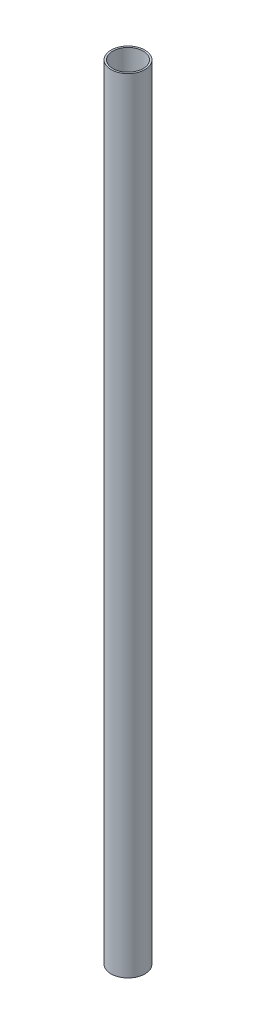
from build123d import *

# Parameters (mm, degrees)
SKETCH1_R           = 3.96875
SKETCH1_R_2         = 3.56235
BOSS_EXTRUDE1_DEPTH = 183.642


with BuildPart() as part:
    # Sketch1 → Boss-Extrude1 (new body)
    with BuildSketch(Plane(origin=(0, 0, 0), x_dir=(1, 0, 0), z_dir=(0, 1, 0))):
        with Locations(Location((0, 0, 0), (0, 0, 270))):
            Circle(SKETCH1_R)
        with Locations(Location((0, 0, 0), (0, 0, 270))):
            Circle(SKETCH1_R_2, mode=Mode.SUBTRACT)
    extrude(amount=BOSS_EXTRUDE1_DEPTH)


solid = part.part
